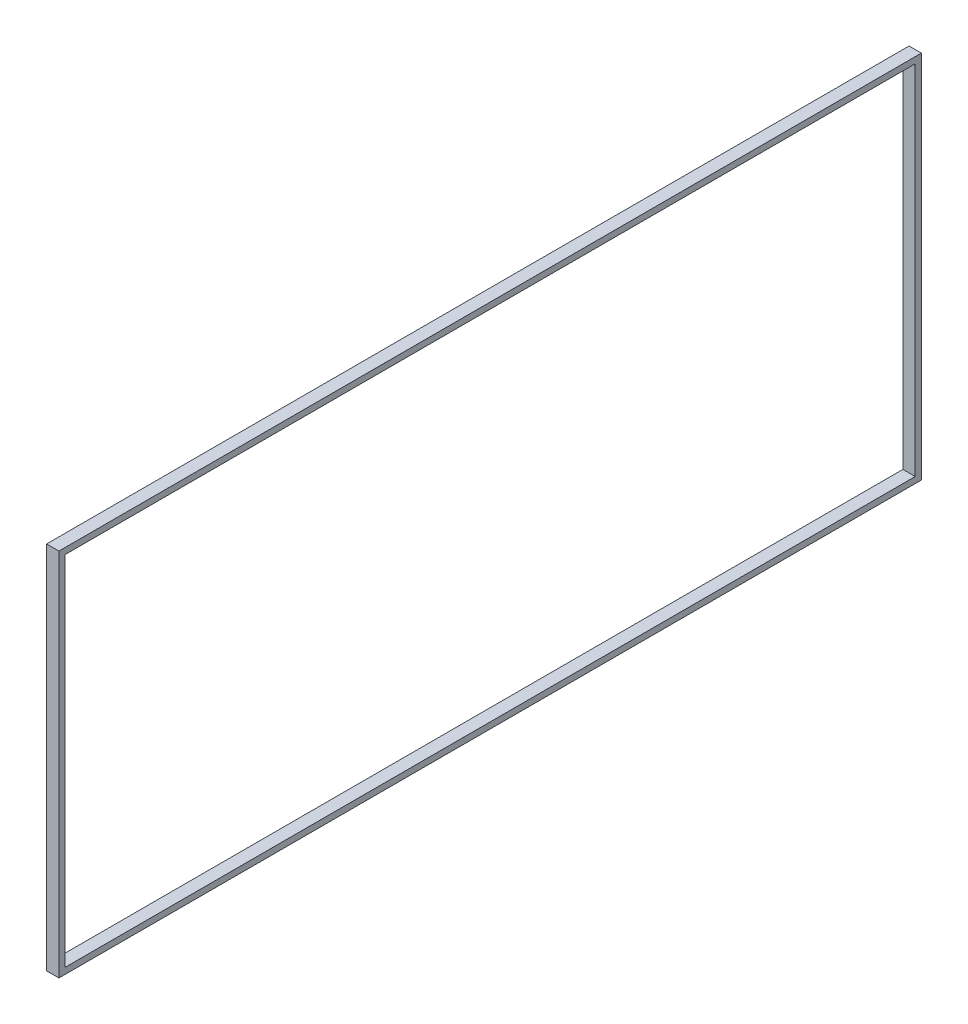
from build123d import *

# Parameters (mm, degrees)
SKETCH1_W           = 7001.9236766
SKETCH1_H           = 3001.90560415
SKETCH1_W_2         = 6901.9236766
SKETCH1_H_2         = 2901.90560415
BOSS_EXTRUDE1_DEPTH = 100


with BuildPart() as part:
    # Sketch1 → Boss-Extrude1 (new body)
    with BuildSketch(Plane(origin=(1477.78, 0, 0), x_dir=(0, 0, -1), z_dir=(1, 0, 0))):
        with Locations((-127.1082083, 525.964637925)):
            Rectangle(SKETCH1_W, SKETCH1_H)
        with Locations((-127.1082083, 525.964637925)):
            Rectangle(SKETCH1_W_2, SKETCH1_H_2, mode=Mode.SUBTRACT)
    extrude(amount=BOSS_EXTRUDE1_DEPTH)


solid = part.part
